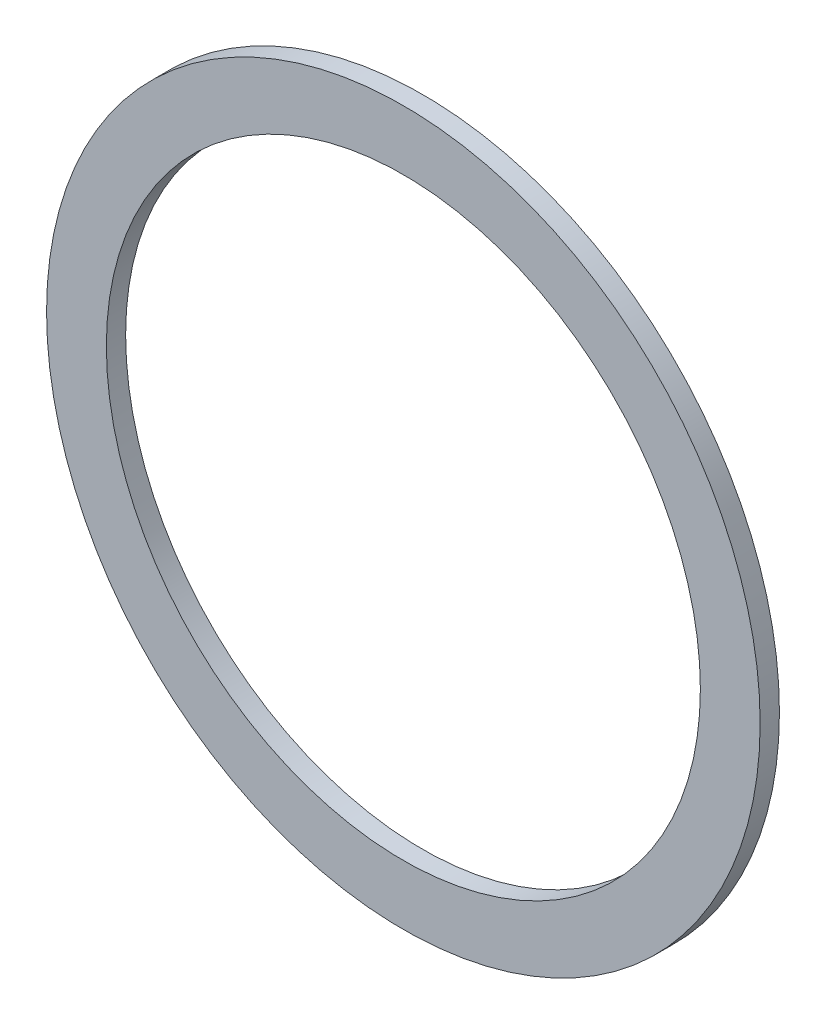
from build123d import *

# Parameters (mm, degrees)
CIRCLIP_ENVELOPE_START = 21.5
SKETCH_1_R             = 18.5
SKETCH_1_R_2           = 15.4
CIRCLIP_ENVELOPE_DEPTH = 1


with BuildPart() as part:
    # Эскиз1 → Circlip_envelope (new body)
    with BuildSketch(Plane.XY.offset(CIRCLIP_ENVELOPE_START)):
        Circle(SKETCH_1_R)
        Circle(SKETCH_1_R_2, mode=Mode.SUBTRACT)
    extrude(amount=CIRCLIP_ENVELOPE_DEPTH)


solid = part.part
